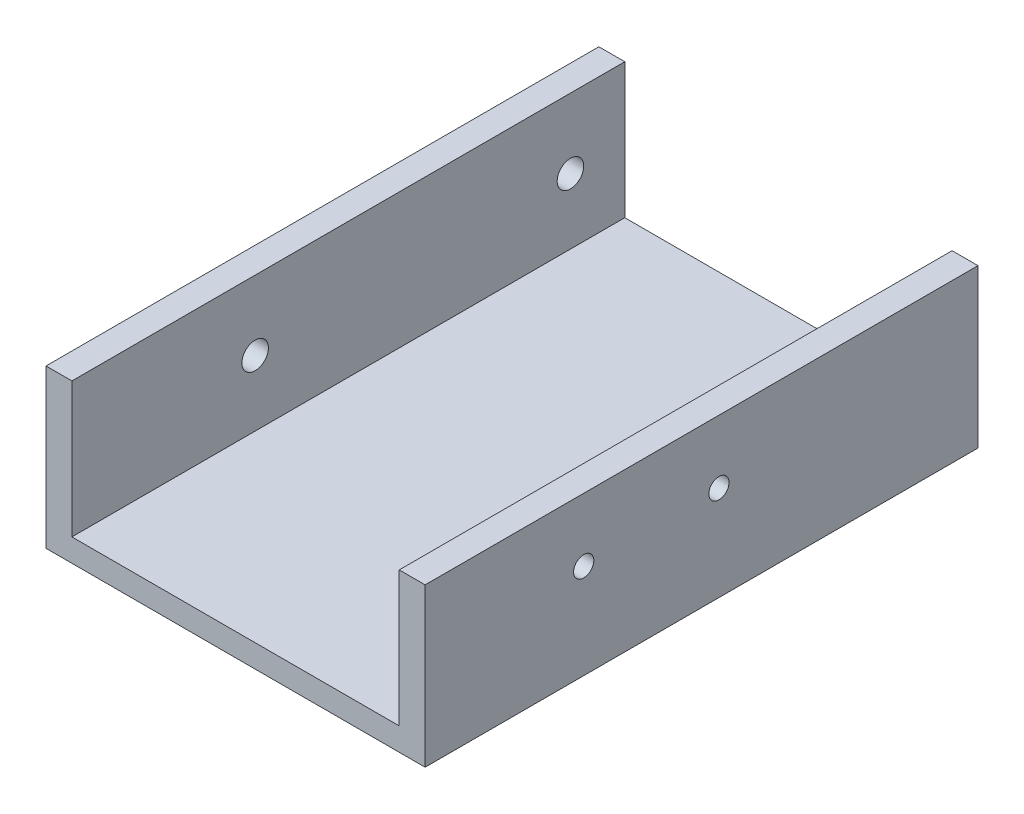
from build123d import *

# Parameters (mm, degrees)
BOSS_EXTRUDE3_DEPTH = 111.125
SKETCH4_R           = 2.667
CUT_EXTRUDE1_DEPTH  = 136.634929771
SKETCH5_R           = 2.667
CUT_EXTRUDE2_DEPTH  = 136.634929771
SKETCH6_R           = 2.032
CUT_EXTRUDE3_DEPTH  = 136.634929771
SKETCH7_R           = 2.032
CUT_EXTRUDE4_DEPTH  = 136.634929771


with BuildPart() as part:
    # Sketch2 → Boss-Extrude3 (new body)
    with BuildSketch(Plane.XY):
        Polygon((-38.1, 0), (38.1, 0), (38.1, 31.75), (32.893, 31.75), (32.893, 4.5974), (-32.893, 4.5974), (-32.893, 31.75), (-38.1, 31.75), align=None)
    extrude(amount=BOSS_EXTRUDE3_DEPTH)

    # Sketch4 → Cut-Extrude1 (cut, through all)
    with BuildSketch(Plane(origin=(-32.893, 0, 0), x_dir=(0, 0, -1), z_dir=(1, 0, 0))):
        with Locations((-10.922, 17.735211787)):
            Circle(SKETCH4_R)
    extrude(amount=-CUT_EXTRUDE1_DEPTH, mode=Mode.SUBTRACT)

    # Sketch5 → Cut-Extrude2 (cut, through all)
    with BuildSketch(Plane(origin=(-32.893, 0, 0), x_dir=(0, 0, -1), z_dir=(1, 0, 0))):
        with Locations((-74.295, 17.78)):
            Circle(SKETCH5_R)
    extrude(amount=-CUT_EXTRUDE2_DEPTH, mode=Mode.SUBTRACT)

    # Sketch6 → Cut-Extrude3 (cut, through all)
    with BuildSketch(Plane.ZY.offset(-32.893)):
        with Locations((52.07, 19.05)):
            Circle(SKETCH6_R)
    extrude(amount=-CUT_EXTRUDE3_DEPTH, mode=Mode.SUBTRACT)

    # Sketch7 → Cut-Extrude4 (cut, through all)
    with BuildSketch(Plane.ZY.offset(-32.893)):
        with Locations((79.248, 19.05)):
            Circle(SKETCH7_R)
    extrude(amount=-CUT_EXTRUDE4_DEPTH, mode=Mode.SUBTRACT)


solid = part.part
